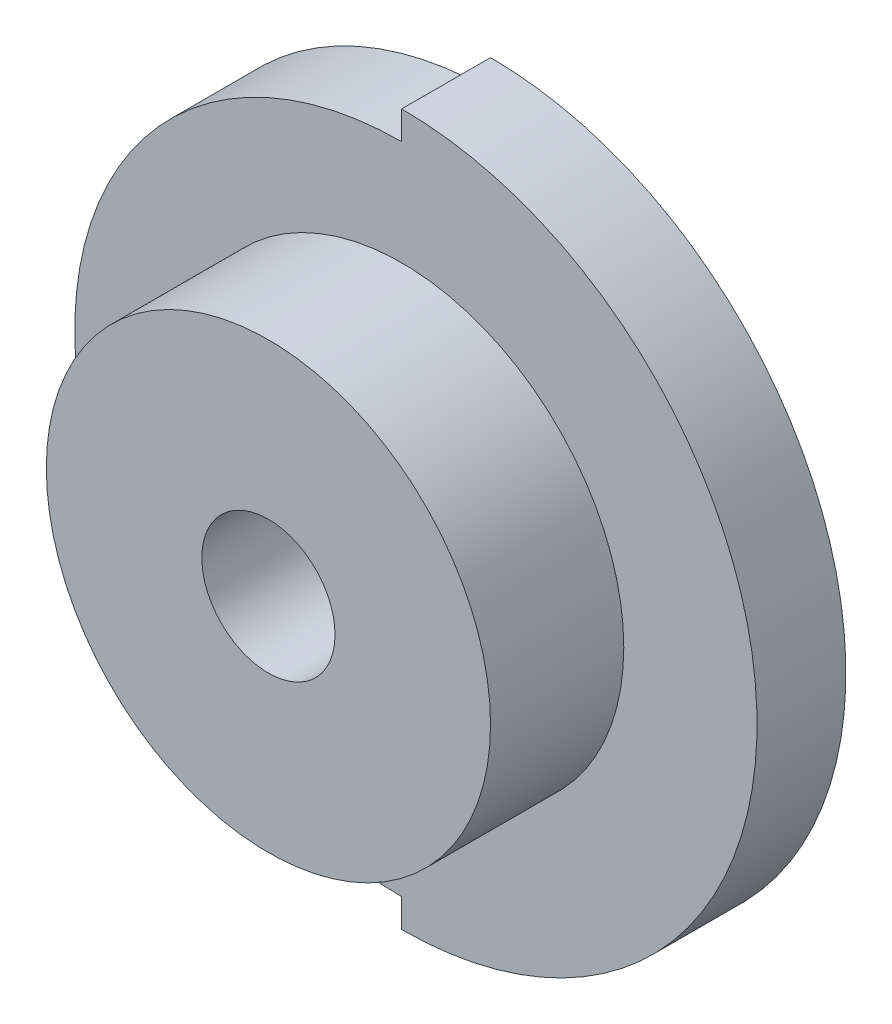
from build123d import *

# Parameters (mm, degrees)
SKETCH1_R           = 25.4
BOSS_EXTRUDE1_DEPTH = 6.35
SKETCH2_R           = 15.875
BOSS_EXTRUDE2_DEPTH = 9.525
SKETCH3_R           = 4.7625
CUT_EXTRUDE1_DEPTH  = 15.875
CUT_EXTRUDE2_DEPTH  = 6.35


with BuildPart() as part:
    # Sketch1 → Boss-Extrude1 (new body)
    with BuildSketch(Plane.XY):
        Circle(SKETCH1_R)
    extrude(amount=BOSS_EXTRUDE1_DEPTH)

    # Sketch2 → Boss-Extrude2 (add)
    with BuildSketch(Plane.XY.offset(6.35)):
        with Locations(Location((0, 0, 0), (0, 0, 180))):
            Circle(SKETCH2_R)
    extrude(amount=BOSS_EXTRUDE2_DEPTH)

    # Sketch3 → Cut-Extrude1 (cut)
    with BuildSketch(Plane.XY.offset(15.875)):
        Circle(SKETCH3_R)
    extrude(amount=-CUT_EXTRUDE1_DEPTH, mode=Mode.SUBTRACT)

    # Sketch4 → Cut-Extrude2 (cut)
    with BuildSketch(Plane(origin=(0, 0, 0), x_dir=(-1, 0, 0), z_dir=(0, 0, -1))):
        with BuildLine():
            Line((0, 25.4), (0, 23.368))
            ThreePointArc((0, 23.368), (23.368, 0), (0, -23.368))
            Line((0, -23.368), (0, -25.4))
            ThreePointArc((0, -25.4), (25.4, 0), (0, 25.4))
        make_face()
    extrude(amount=-CUT_EXTRUDE2_DEPTH, mode=Mode.SUBTRACT)


solid = part.part
